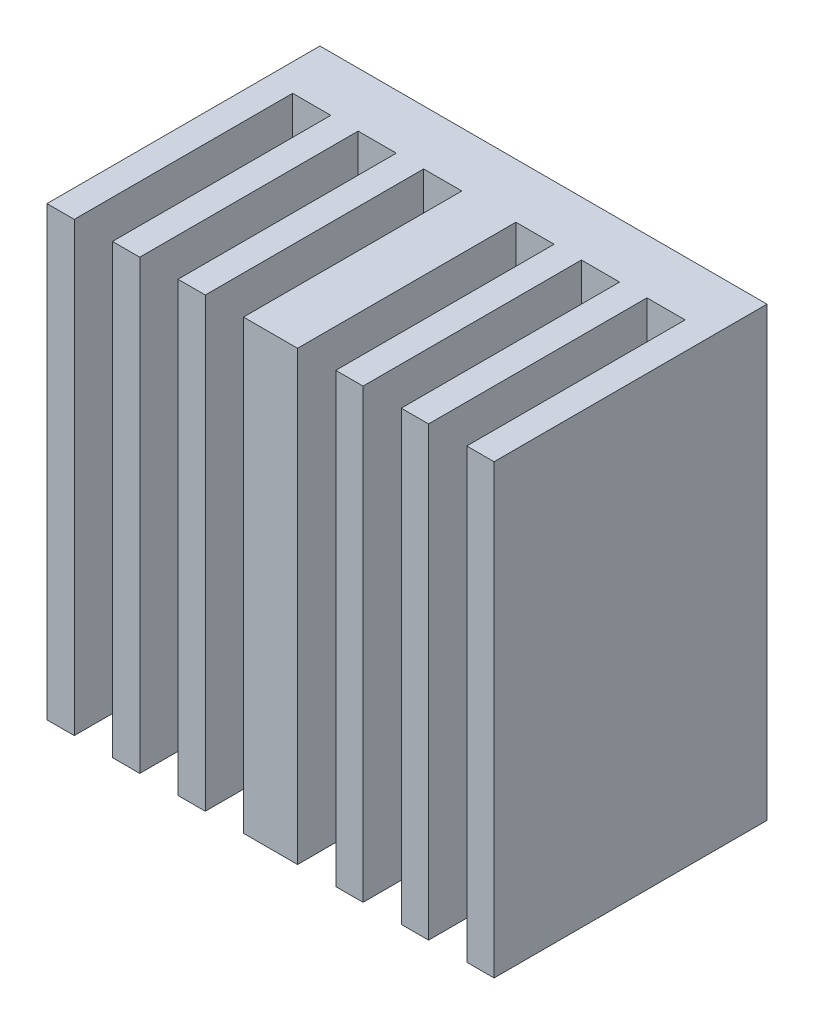
from build123d import *

# Parameters (mm, degrees)
ESQUISSE1_W             = 8.19
ESQUISSE1_H             = 8.19
BOSS_EXTRU_1_DEPTH      = 5
ESQUISSE2_W             = 0.7
ESQUISSE2_H             = 8.19
ENL_V_MAT_EXTRU_1_DEPTH = 4


with BuildPart() as part:
    # Esquisse1 → Boss.-Extru.1 (new body)
    with BuildSketch(Plane.XY):
        with Locations((4.095, 4.095)):
            Rectangle(ESQUISSE1_W, ESQUISSE1_H)
    extrude(amount=BOSS_EXTRU_1_DEPTH)

    # Esquisse2 → Enlèv. mat.-Extru.1 (cut)
    with BuildSketch(Plane.XY.offset(5)):
        with Locations((0.85, 4.095)):
            Rectangle(ESQUISSE2_W, ESQUISSE2_H)
        with Locations((2.05, 4.095)):
            Rectangle(ESQUISSE2_W, ESQUISSE2_H)
        with Locations((4.94, 4.095)):
            Rectangle(ESQUISSE2_W, ESQUISSE2_H)
        with Locations((3.25, 4.095)):
            Rectangle(ESQUISSE2_W, ESQUISSE2_H)
        with Locations((6.14, 4.095)):
            Rectangle(ESQUISSE2_W, ESQUISSE2_H)
        with Locations((7.34, 4.095)):
            Rectangle(ESQUISSE2_W, ESQUISSE2_H)
    extrude(amount=-ENL_V_MAT_EXTRU_1_DEPTH, mode=Mode.SUBTRACT)


solid = part.part
